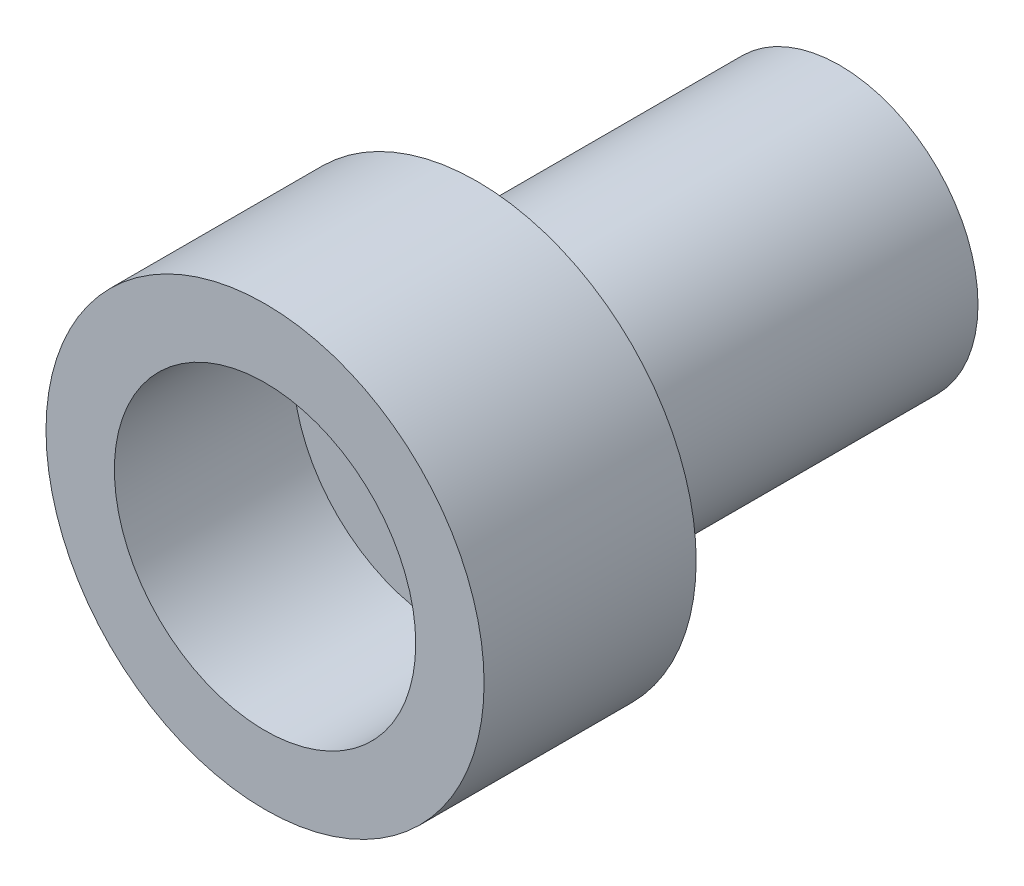
from build123d import *


with BuildPart() as part:
    # Croquis1 → Revolución1 (revolve)
    with BuildSketch(Plane(origin=(0, 0, 0), x_dir=(0, 0, -1), z_dir=(1, 0, 0)), mode=Mode.PRIVATE) as revoluci_n1_sk:
        Polygon((-3.8, 3.925), (0, 3.925), (0, 2.475), (6.5, 2.475), (6.5, 1.45), (-0.6, 1.45), (-0.6, 2.7), (-3.8, 2.7), align=None)
    revolve(revoluci_n1_sk.sketch.rotate(Axis((0, 0, 10.712513893), (0, 0, -1)), 90), axis=Axis((0, 0, 10.712513893), (0, 0, -1)))


solid = part.part
